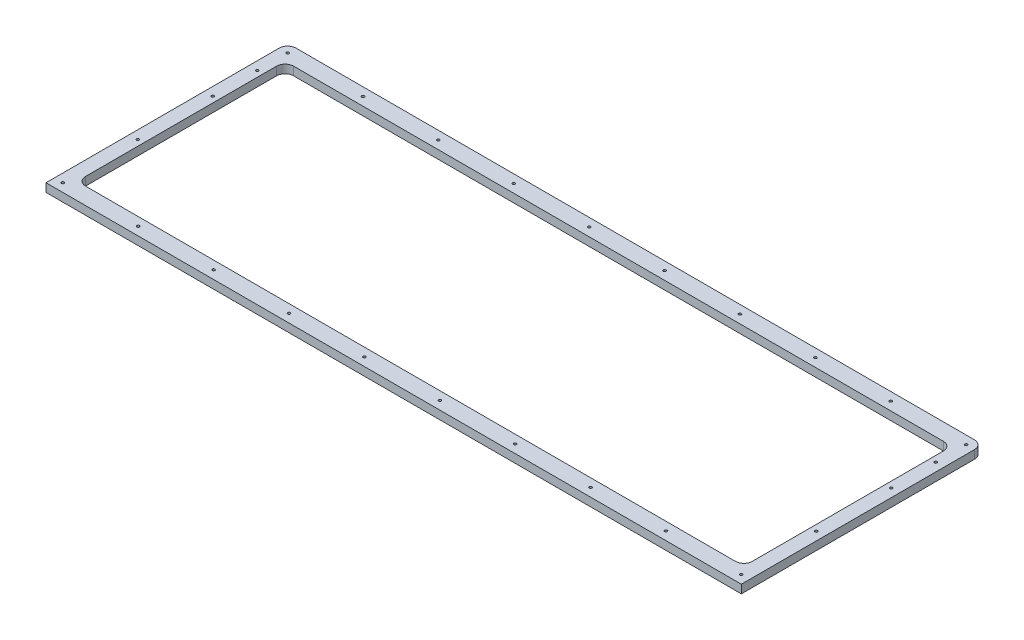
from build123d import *

# Parameters (mm, degrees)
DODANIE_WYCI_GNI_CIE1_DEPTH = 10
WYTNIJ_WYCI_GNI_CIE1_DEPTH  = 10
SZKIC4_R                    = 1.55
WYTNIJ_WYCI_GNI_CIE2_DEPTH  = 10
SZYK_LINIOWY1_COUNT         = 9
SZYK_LINIOWY1_PITCH         = 89.555
SZYK_LINIOWY1_COL_COUNT     = 4
SZYK_LINIOWY1_COL_PITCH     = 89
SZKIC6_R                    = 1.55
WYTNIJ_WYCI_GNI_CIE3_DEPTH  = 10
SZYK_LINIOWY2_COUNT         = 4
SZYK_LINIOWY2_PITCH         = 89
SZYK_LINIOWY2_COL_COUNT     = 9
SZYK_LINIOWY2_COL_PITCH     = 89.555
SZYK_LINIOWY3_COUNT         = 2
SZYK_LINIOWY3_PITCH         = 36
SZYK_LINIOWY4_COUNT         = 2
SZYK_LINIOWY4_PITCH         = 231


with BuildPart() as part:
    # Szkic2 → Dodanie-wyciągnięcie1 (new body)
    with BuildSketch(Plane.ZX.offset(1505.947389818)):
        with BuildLine():
            Line((-183.955224703, 657.685033185), (-183.955224703, -148.314966815))
            ThreePointArc((-183.955224703, -148.314966815), (-181.026292515, -155.386034627), (-173.955224703, -158.314966815))
            Line((-173.955224703, -158.314966815), (103.044775297, -158.314966815))
            Line((103.044775297, -158.314966815), (103.044775297, 667.685033185))
            Line((103.044775297, 667.685033185), (-173.955224703, 667.685033185))
            ThreePointArc((-173.955224703, 667.685033185), (-181.026292515, 664.756100997), (-183.955224703, 657.685033185))
        make_face()
    extrude(amount=DODANIE_WYCI_GNI_CIE1_DEPTH)

    # Szkic3 → Wytnij-wyciągnięcie1 (cut)
    with BuildSketch(Plane(origin=(0, 1515.947389818, 0), x_dir=(1, 0, 0), z_dir=(0, 1, 0))):
        with BuildLine():
            Line((650.685033185, -73.044775297), (650.685033185, 153.955224703))
            ThreePointArc((650.685033185, 153.955224703), (647.756100997, 161.026292515), (640.685033185, 163.955224703))
            Line((640.685033185, 163.955224703), (-131.314966815, 163.955224703))
            ThreePointArc((-131.314966815, 163.955224703), (-138.386034627, 161.026292515), (-141.314966815, 153.955224703))
            Line((-141.314966815, 153.955224703), (-141.314966815, -73.044775297))
            ThreePointArc((-141.314966815, -73.044775297), (-138.386034627, -80.115843109), (-131.314966815, -83.044775297))
            Line((-131.314966815, -83.044775297), (640.685033185, -83.044775297))
            ThreePointArc((640.685033185, -83.044775297), (647.756100997, -80.115843109), (650.685033185, -73.044775297))
        make_face()
    extrude(amount=-WYTNIJ_WYCI_GNI_CIE1_DEPTH, mode=Mode.SUBTRACT)

    # Szkic4 → Wytnij-wyciągnięcie2 (cut)
    with BuildSketch(Plane(origin=(0, 1515.947389818, 0), x_dir=(1, 0, 0), z_dir=(0, 1, 0))):
        with Locations(Location((657.685033185, 173.955224703, 0), (0, 0, 270))):
            Circle(SZKIC4_R)
    wytnij_wyci_gni_cie2 = extrude(amount=-WYTNIJ_WYCI_GNI_CIE2_DEPTH, mode=Mode.SUBTRACT)

    # Szyk liniowy1: Wytnij-wyciągnięcie2 ×9
    with Locations(*[(-i * SZYK_LINIOWY1_PITCH, 0, 0) for i in range(1, SZYK_LINIOWY1_COUNT)]):
        add(wytnij_wyci_gni_cie2, mode=Mode.SUBTRACT)

    # Szyk liniowy1 col: Wytnij-wyciągnięcie2 ×4
    with Locations(*[(0, 0, i * SZYK_LINIOWY1_COL_PITCH) for i in range(1, SZYK_LINIOWY1_COL_COUNT)]):
        add(wytnij_wyci_gni_cie2, mode=Mode.SUBTRACT)

    # Szkic6 → Wytnij-wyciągnięcie3 (cut)
    with BuildSketch(Plane(origin=(0, 1515.947389818, 0), x_dir=(1, 0, 0), z_dir=(0, 1, 0))):
        with Locations(Location((-148.314966815, -93.044775297, 0), (0, 0, 270))):
            Circle(SZKIC6_R)
    wytnij_wyci_gni_cie3 = extrude(amount=-WYTNIJ_WYCI_GNI_CIE3_DEPTH, mode=Mode.SUBTRACT)

    # Szyk liniowy2: Wytnij-wyciągnięcie3 ×4
    with Locations(*[(0, 0, -i * SZYK_LINIOWY2_PITCH) for i in range(1, SZYK_LINIOWY2_COUNT)]):
        add(wytnij_wyci_gni_cie3, mode=Mode.SUBTRACT)

    # Szyk liniowy2 col: Wytnij-wyciągnięcie3 ×9
    with Locations(*[(i * SZYK_LINIOWY2_COL_PITCH, 0, 0) for i in range(1, SZYK_LINIOWY2_COL_COUNT)]):
        add(wytnij_wyci_gni_cie3, mode=Mode.SUBTRACT)

    # Szyk liniowy3: Wytnij-wyciągnięcie2 ×2
    with Locations(*[(0, 0, i * SZYK_LINIOWY3_PITCH) for i in range(1, SZYK_LINIOWY3_COUNT)]):
        add(wytnij_wyci_gni_cie2, mode=Mode.SUBTRACT)

    # Szyk liniowy4: Wytnij-wyciągnięcie3 ×2
    with Locations(*[(0, 0, -i * SZYK_LINIOWY4_PITCH) for i in range(1, SZYK_LINIOWY4_COUNT)]):
        add(wytnij_wyci_gni_cie3, mode=Mode.SUBTRACT)


solid = part.part
